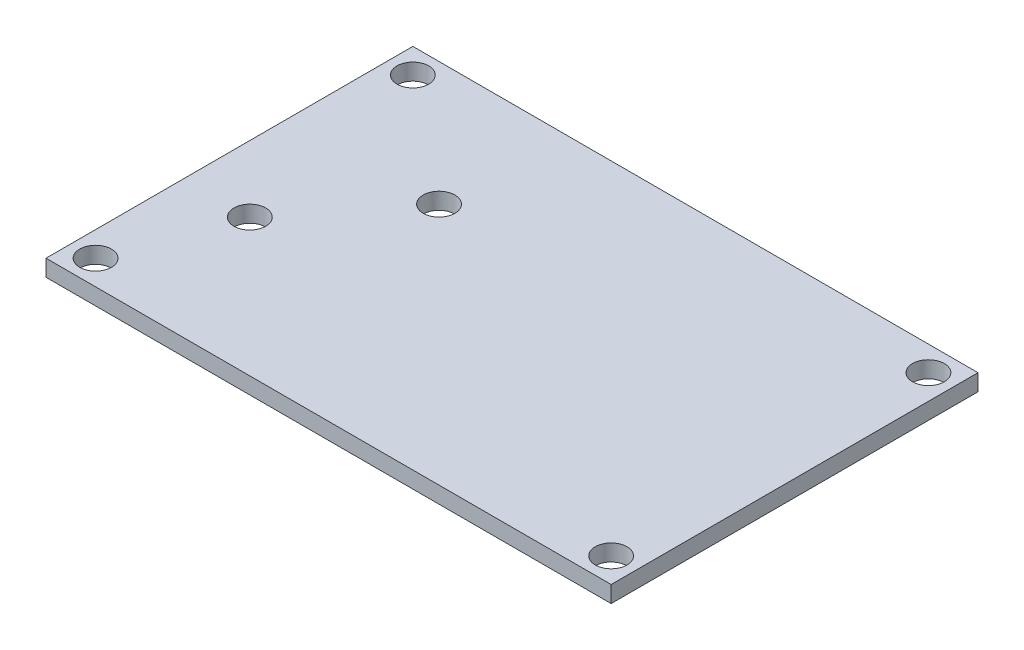
from build123d import *

# Parameters (mm, degrees)
SKETCH1_W           = 57
SKETCH1_H           = 37
BOSS_EXTRUDE1_DEPTH = 1.67
SKETCH2_R           = 1.6
CUT_EXTRUDE1_DEPTH  = 1.67


with BuildPart() as part:
    # Sketch1 → Boss-Extrude1 (new body)
    with BuildSketch(Plane(origin=(0, 0, 0), x_dir=(1, 0, 0), z_dir=(0, 1, 0))):
        Rectangle(SKETCH1_W, SKETCH1_H)
    extrude(amount=BOSS_EXTRUDE1_DEPTH)

    # Sketch2 → Cut-Extrude1 (cut)
    with BuildSketch(Plane(origin=(0, 1.67, 0), x_dir=(1, 0, 0), z_dir=(0, 1, 0))):
        with Locations(Location((-26, -16, 0), (0, 0, 270))):
            Circle(SKETCH2_R)
        with Locations(Location((-26, 16, 0), (0, 0, 270))):
            Circle(SKETCH2_R)
        with Locations(Location((26, -16, 0), (0, 0, 270))):
            Circle(SKETCH2_R)
        with Locations(Location((26, 16, 0), (0, 0, 270))):
            Circle(SKETCH2_R)
        with Locations(Location((-13.4, 6.04, 0), (0, 0, 270))):
            Circle(SKETCH2_R)
        with Locations(Location((-21.81, -4.63, 0), (0, 0, 270))):
            Circle(SKETCH2_R)
    extrude(amount=-CUT_EXTRUDE1_DEPTH, mode=Mode.SUBTRACT)


solid = part.part
